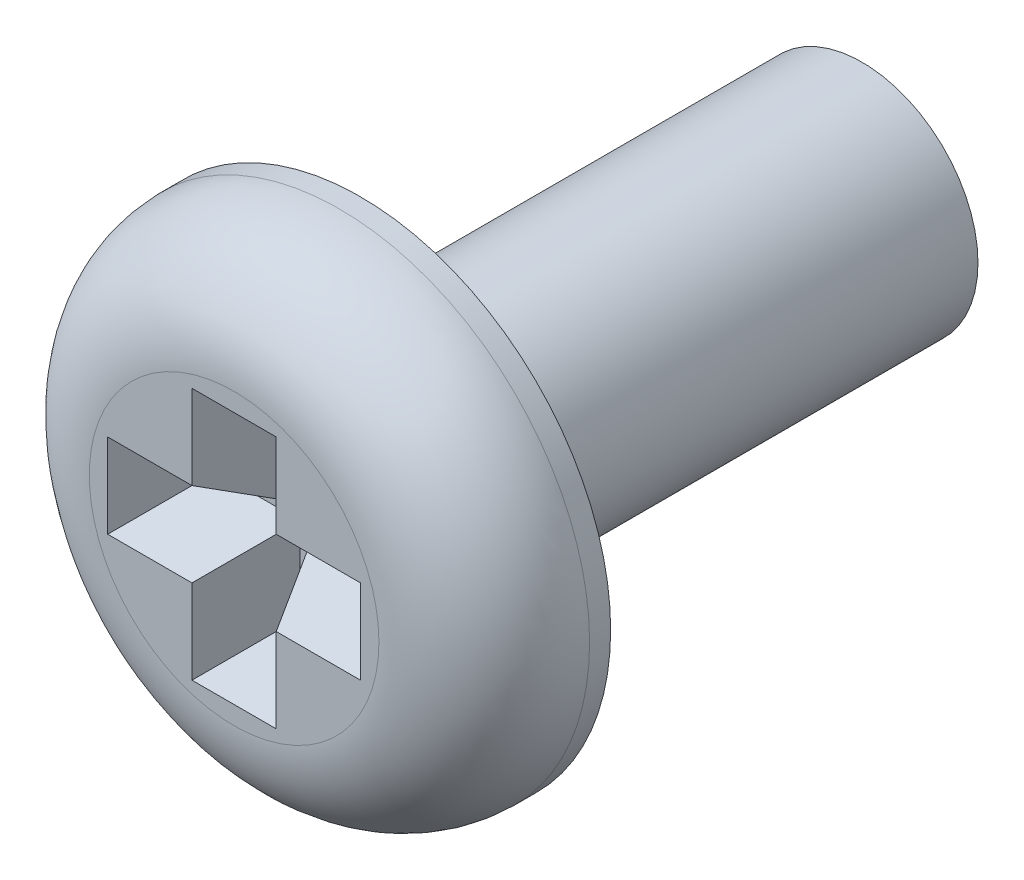
from build123d import *

# Parameters (mm, degrees)
SKETCH1_R          = 2.375
EXTRUDE1_DEPTH     = 1.2
FILLET1_R          = 1
CUT_EXTRUDE1_DEPTH = 0.7
CUT_EXTRUDE1_DRAFT = -25
SKETCH3_R          = 1.1
EXTRUDE2_DEPTH     = 4.7625


with BuildPart() as part:
    # Sketch1 → Extrude1 (new body)
    with BuildSketch(Plane.XY):
        Circle(SKETCH1_R)
    extrude(amount=EXTRUDE1_DEPTH)

    # Fillet1
    fillet1_edges = [part.edges().sort_by_distance(p)[0] for p in [
        (-2.375, 0, 1.2),
    ]]
    fillet(fillet1_edges, radius=FILLET1_R)


with BuildPart() as cut_extrude1_tool:
    # Sketch2 → Cut-Extrude1 (with draft: the straight prism first)
    with BuildSketch(Plane.XY.offset(1.2)):
        Polygon((-0.4, 0.4), (-1.2, 0.4), (-1.2, -0.4), (-0.4, -0.4), (-0.4, -1.2), (0.4, -1.2), (0.4, -0.4), (1.2, -0.4), (1.2, 0.4), (0.4, 0.4), (0.4, 1.2), (-0.4, 1.2), align=None)
    extrude(amount=-CUT_EXTRUDE1_DEPTH)
    # Cut-Extrude1: the draft: its side faces are tilted about the plane it starts from
    cut_extrude1_sides = [cut_extrude1_tool.faces().sort_by_distance(p)[0] for p in [
        (-0.8, 0.4, 0.85),
        (-1.2, 0, 0.85),
        (-0.8, -0.4, 0.85),
        (-0.4, -0.8, 0.85),
        (0, -1.2, 0.85),
        (0.4, -0.8, 0.85),
        (0.8, -0.4, 0.85),
        (1.2, 0, 0.85),
        (0.8, 0.4, 0.85),
        (0.4, 0.8, 0.85),
        (0, 1.2, 0.85),
        (-0.4, 0.8, 0.85),
    ]]
    draft(cut_extrude1_sides, Plane.XY.offset(1.2), CUT_EXTRUDE1_DRAFT)


with BuildPart() as part_1:
    add(part.part)

    # Cut-Extrude1: cut by cut_extrude1_tool
    add(cut_extrude1_tool.part, mode=Mode.SUBTRACT)

    # Sketch3 → Extrude2 (add)
    with BuildSketch(Plane(origin=(0, 0, 0), x_dir=(-1, 0, 0), z_dir=(0, 0, -1))):
        with Locations(Location((0, 0, 0), (0, 0, 180))):
            Circle(SKETCH3_R)
    extrude(amount=EXTRUDE2_DEPTH)


solid = part_1.part
